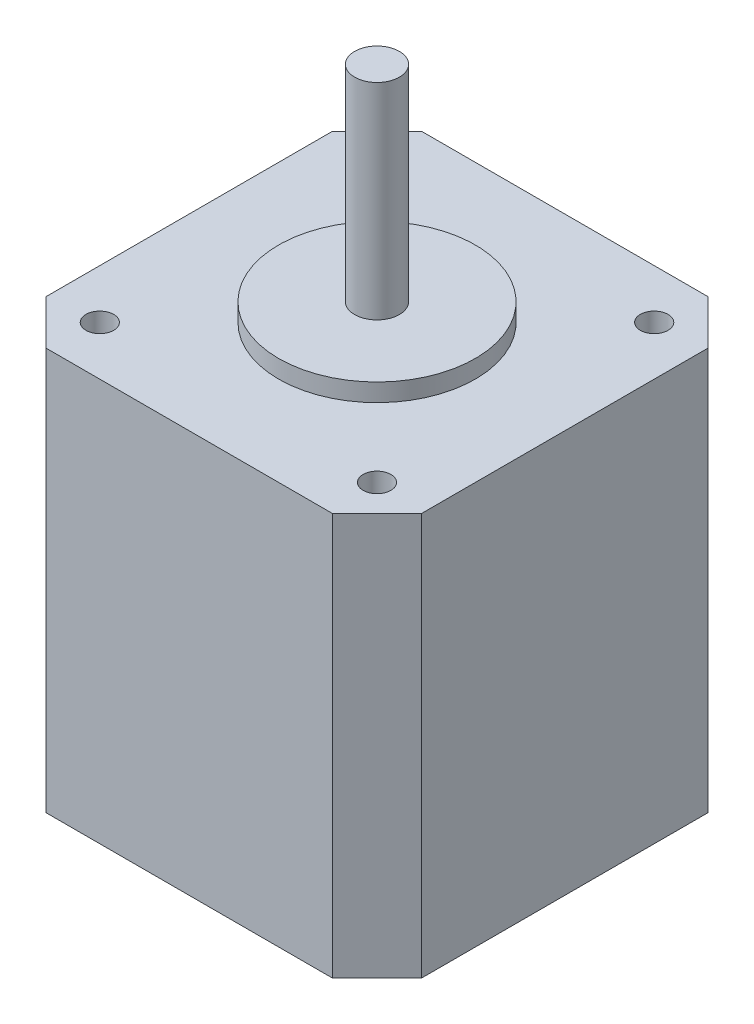
from build123d import *

# Parameters (mm, degrees)
EXTRUDE_1_DEPTH     = 45
SKETCH_2_R          = 11
EXTRUDE_2_DEPTH     = 2
SKETCH_3_R          = 2.5
EXTRUDE_3_DEPTH     = 23
SKETCH_4_R          = 1.55
CUT_EXTRUDE_1_DEPTH = 5


with BuildPart() as part:
    # 草图1 → 凸台-拉伸1 (new body)
    with BuildSketch(Plane(origin=(0, 0, 0), x_dir=(1, 0, 0), z_dir=(0, 1, 0))):
        Polygon((-16, 21), (-21, 16), (-21, -16), (-16, -21), (16, -21), (21, -16), (21, 16), (16, 21), align=None)
    extrude(amount=EXTRUDE_1_DEPTH)

    # 草图2 → 凸台-拉伸2 (add)
    with BuildSketch(Plane(origin=(0, 45, 0), x_dir=(1, 0, 0), z_dir=(0, 1, 0))):
        with Locations(Location((0, 0, 0), (0, 0, 270))):
            Circle(SKETCH_2_R)
    extrude(amount=EXTRUDE_2_DEPTH)

    # 草图3 → 凸台-拉伸3 (add)
    with BuildSketch(Plane(origin=(0, 47, 0), x_dir=(1, 0, 0), z_dir=(0, 1, 0))):
        with Locations(Location((0, 0, 0), (0, 0, 270))):
            Circle(SKETCH_3_R)
    extrude(amount=EXTRUDE_3_DEPTH)

    # 草图4 → 切除-拉伸1 (cut)
    with BuildSketch(Plane(origin=(0, 45, 0), x_dir=(1, 0, 0), z_dir=(0, 1, 0))):
        with Locations(Location((-15.5, 15.5, 0), (0, 0, 270))):
            Circle(SKETCH_4_R)
        with Locations(Location((15.5, 15.5, 0), (0, 0, 270))):
            Circle(SKETCH_4_R)
        with Locations(Location((-15.5, -15.5, 0), (0, 0, 270))):
            Circle(SKETCH_4_R)
        with Locations(Location((15.5, -15.5, 0), (0, 0, 270))):
            Circle(SKETCH_4_R)
    extrude(amount=-CUT_EXTRUDE_1_DEPTH, mode=Mode.SUBTRACT)


solid = part.part
